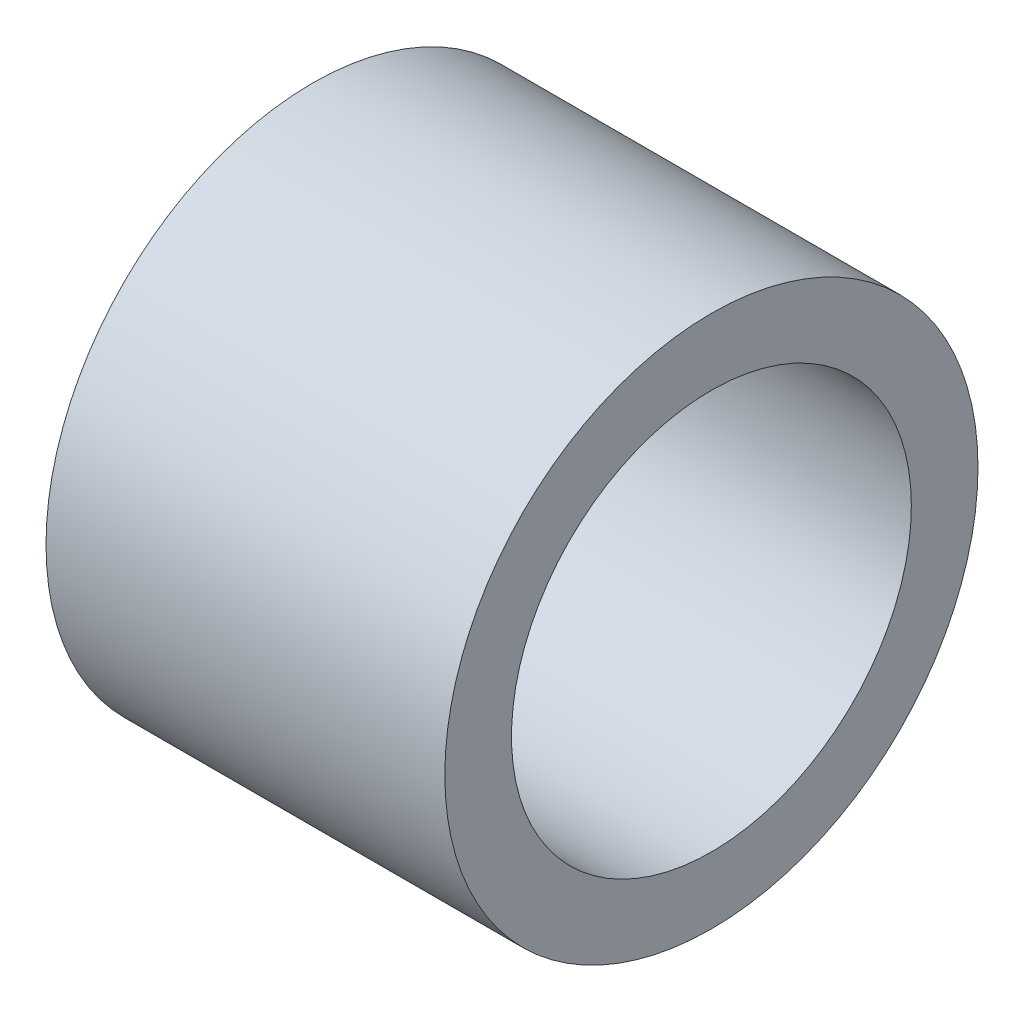
from build123d import *

# Parameters (mm, degrees)
SKETCH1_R           = 12.7
SKETCH1_R_2         = 9.525
BOSS_EXTRUDE1_DEPTH = 9.5


with BuildPart() as part:
    # Sketch1 → Boss-Extrude1 (new, symmetric)
    with BuildSketch(Plane(origin=(0, 0, 0), x_dir=(0, 0, -1), z_dir=(1, 0, 0))):
        Circle(SKETCH1_R)
        Circle(SKETCH1_R_2, mode=Mode.SUBTRACT)
    extrude(amount=BOSS_EXTRUDE1_DEPTH, both=True)


solid = part.part
